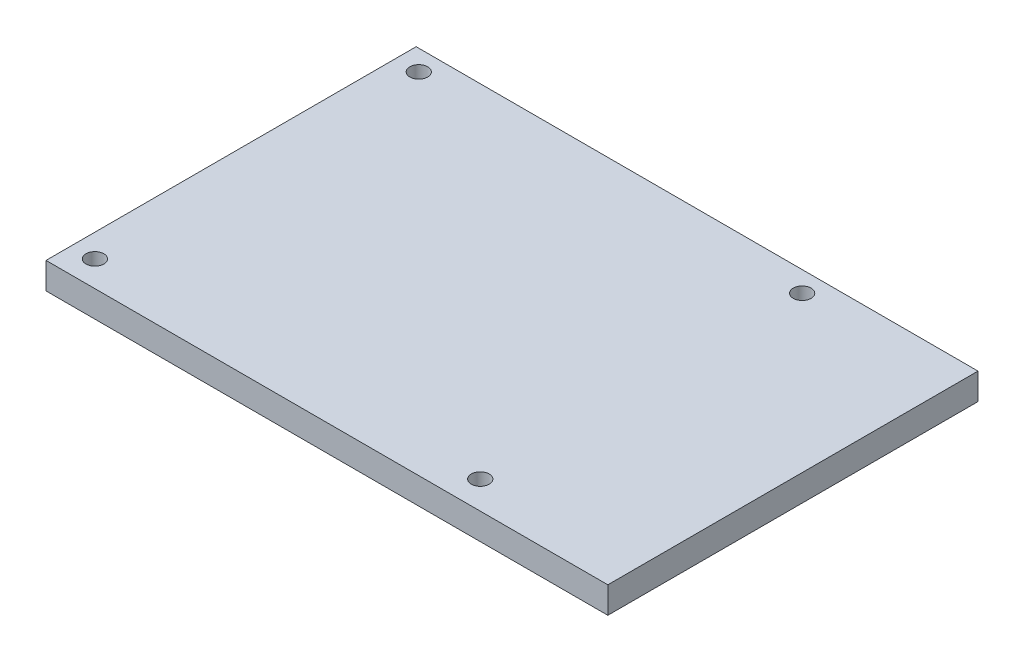
from build123d import *

# Parameters (mm, degrees)
SKETCH_1_W      = 85
SKETCH_1_H      = 56
SKETCH_1_R      = 1.35
EXTRUDE_1_DEPTH = 4


with BuildPart() as part:
    # 草图1 → 凸台-拉伸1 (new body)
    with BuildSketch(Plane(origin=(0, 0, 0), x_dir=(1, 0, 0), z_dir=(0, 1, 0))):
        with Locations((-6.766244493, -10.225674706)):
            Rectangle(SKETCH_1_W, SKETCH_1_H)
        with Locations(Location((-45.766244493, 14.67042919, 0), (0, 0, 270))):
            Circle(SKETCH_1_R, mode=Mode.SUBTRACT)
        with Locations(Location((12.233755507, 14.67042919, 0), (0, 0, 270))):
            Circle(SKETCH_1_R, mode=Mode.SUBTRACT)
        with Locations(Location((-45.766244493, -34.32957081, 0), (0, 0, 270))):
            Circle(SKETCH_1_R, mode=Mode.SUBTRACT)
        with Locations(Location((12.232959356, -34.025674706, 0), (0, 0, 270))):
            Circle(SKETCH_1_R, mode=Mode.SUBTRACT)
    extrude(amount=EXTRUDE_1_DEPTH)


solid = part.part
